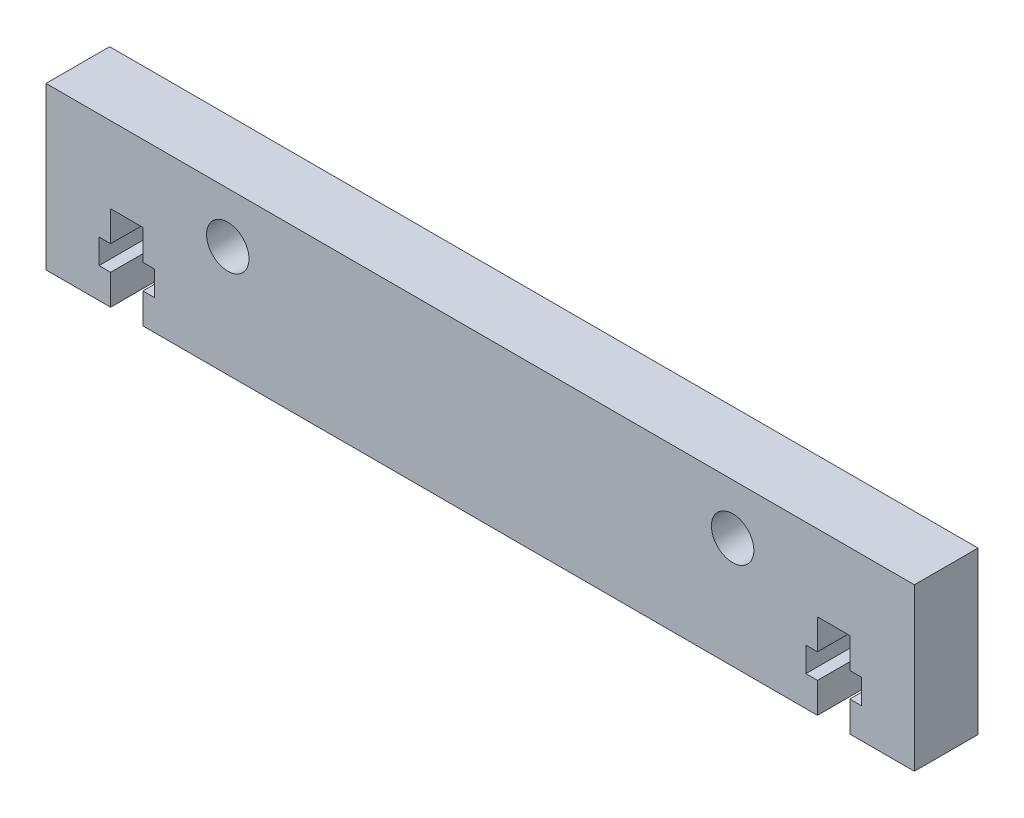
from build123d import *

# Parameters (mm, degrees)
SKETCH1_R           = 2.1
BOSS_EXTRUDE1_DEPTH = 6.3


with BuildPart() as part:
    # Sketch1 → Boss-Extrude1 (new body)
    with BuildSketch(Plane.XY):
        Polygon((33.4, 0), (-33.4, 0), (-33.4, 3), (-32.25, 3), (-32.25, 5.45), (-33.4, 5.45), (-33.4, 8.45), (-36.6, 8.45), (-36.6, 5.45), (-37.75, 5.45), (-37.75, 3), (-36.6, 3), (-36.6, 0), (-43, 0), (-43, 16), (43, 16), (43, 0), (36.6, 0), (36.6, 3), (37.75, 3), (37.75, 5.45), (36.6, 5.45), (36.6, 8.45), (33.4, 8.45), (33.4, 5.45), (32.25, 5.45), (32.25, 3), (33.4, 3), align=None)
        with Locations((-25, 11)):
            Circle(SKETCH1_R, mode=Mode.SUBTRACT)
        with Locations(Location((25, 11, 0), (0, 0, 180))):
            Circle(SKETCH1_R, mode=Mode.SUBTRACT)
    extrude(amount=BOSS_EXTRUDE1_DEPTH)


solid = part.part
